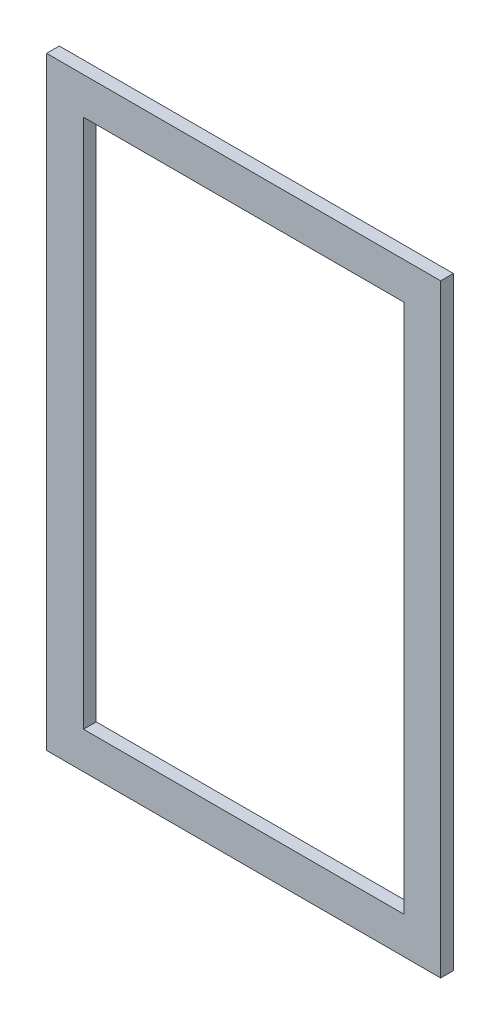
from build123d import *

# Parameters (mm, degrees)
ESBO_O1_W                = 31
ESBO_O1_H                = 47.5
ESBO_O1_W_2              = 25.2
ESBO_O1_H_2              = 41.7
RESSALTO_EXTRUS_O1_DEPTH = 1


with BuildPart() as part:
    # Esboço1 → Ressalto-extrusão1 (new body)
    with BuildSketch(Plane.XY):
        with Locations((15.5, 23.75)):
            Rectangle(ESBO_O1_W, ESBO_O1_H)
        with Locations((15.5, 23.75)):
            Rectangle(ESBO_O1_W_2, ESBO_O1_H_2, mode=Mode.SUBTRACT)
    extrude(amount=RESSALTO_EXTRUS_O1_DEPTH)


solid = part.part
